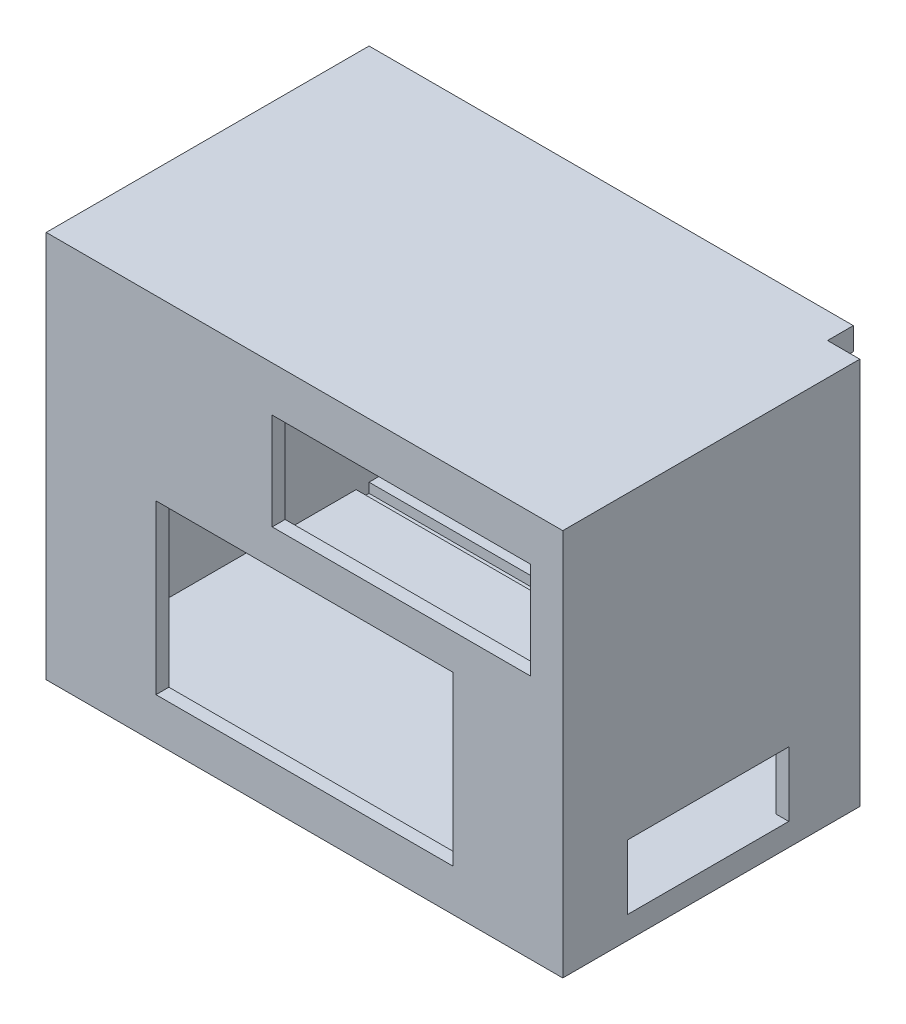
from build123d import *

# Parameters (mm, degrees)
SKETCH_1_W          = 80
SKETCH_1_H          = 60
EXTRUDE_1_DEPTH     = 50
SKETCH_1_3_W        = 76
SKETCH_1_3_H        = 53
CUT_EXTRUDE_1_DEPTH = 48
SKETCH_1_4_W        = 40
SKETCH_1_4_H        = 15
CUT_EXTRUDE_2_DEPTH = 50
SKETCH_1_5_W        = 46
SKETCH_1_5_H        = 26
CUT_EXTRUDE_3_DEPTH = 50
CUT_EXTRUDE_5_DEPTH = 4
CUT_EXTRUDE_START   = 2
SKETCH_1_9_W        = 73
SKETCH_1_9_H        = 56
CUT_EXTRUDE_6_DEPTH = 2
SKETCH_2_W          = 20
SKETCH_2_H          = 20
CUT_EXTRUDE_7_DEPTH = 2
SKETCH_3_W          = 25
SKETCH_3_H          = 10
CUT_EXTRUDE_8_DEPTH = 2


with BuildPart() as part:
    # 草图1 → 凸台-拉伸1 (new body)
    with BuildSketch(Plane.XY):
        with Locations((40, 30)):
            Rectangle(SKETCH_1_W, SKETCH_1_H)
    extrude(amount=EXTRUDE_1_DEPTH)

    # 草图1<3> → 切除-拉伸1 (cut)
    with BuildSketch(Plane.XY):
        with Locations((40, 30)):
            Rectangle(SKETCH_1_3_W, SKETCH_1_3_H)
    extrude(amount=CUT_EXTRUDE_1_DEPTH, mode=Mode.SUBTRACT)

    # 草图1<4> → 切除-拉伸2 (cut)
    with BuildSketch(Plane.XY):
        with Locations((55, 45.5)):
            Rectangle(SKETCH_1_4_W, SKETCH_1_4_H)
    extrude(amount=CUT_EXTRUDE_2_DEPTH, mode=Mode.SUBTRACT)

    # 草图1<5> → 切除-拉伸3 (cut)
    with BuildSketch(Plane.XY):
        with Locations((40, 19.5)):
            Rectangle(SKETCH_1_5_W, SKETCH_1_5_H)
    extrude(amount=CUT_EXTRUDE_3_DEPTH, mode=Mode.SUBTRACT)

    # 草图1<7> → 切除-拉伸5 (cut)
    with BuildSketch(Plane.XY):
        Polygon((75, 2), (75, 0), (80, 0), (80, 60), (75, 60), (75, 58), (75, 56.5), (78, 56.5), (78, 3.5), (75, 3.5), align=None)
    extrude(amount=CUT_EXTRUDE_5_DEPTH, mode=Mode.SUBTRACT)

    # 草图1<9> → 切除-拉伸6 (cut)
    with BuildSketch(Plane.XY.offset(CUT_EXTRUDE_START)):
        with Locations((38.5, 30)):
            Rectangle(SKETCH_1_9_W, SKETCH_1_9_H)
    extrude(amount=CUT_EXTRUDE_6_DEPTH, mode=Mode.SUBTRACT)

    # 草图2 → 切除-拉伸7 (cut)
    with BuildSketch(Plane.ZY):
        with Locations((35, 46.5)):
            Rectangle(SKETCH_2_W, SKETCH_2_H)
    extrude(amount=-CUT_EXTRUDE_7_DEPTH, mode=Mode.SUBTRACT)

    # 草图3 → 切除-拉伸8 (cut)
    with BuildSketch(Plane(origin=(80, 0, 0), x_dir=(0, 0, -1), z_dir=(1, 0, 0))):
        with Locations((-27.5, 8.5)):
            Rectangle(SKETCH_3_W, SKETCH_3_H)
    extrude(amount=-CUT_EXTRUDE_8_DEPTH, mode=Mode.SUBTRACT)


solid = part.part
